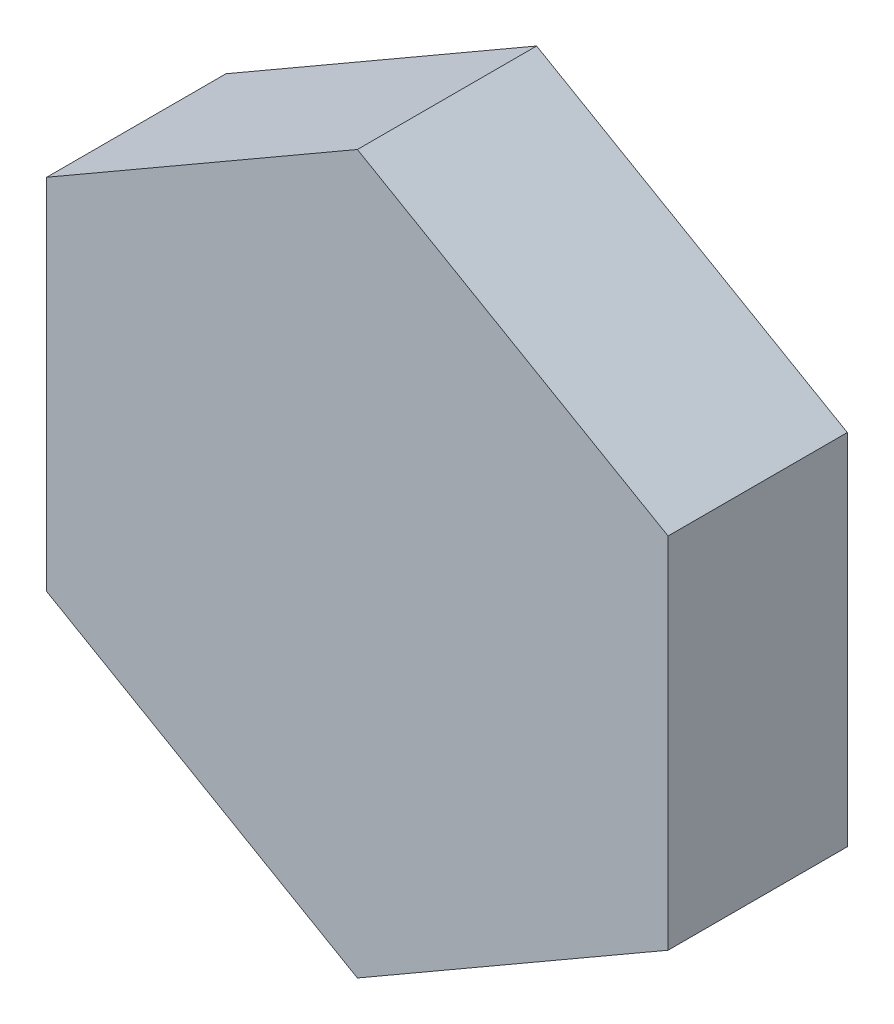
from build123d import *

# Parameters (mm, degrees)
BOSS_EXTRUDE1_DEPTH = 135


with BuildPart() as part:
    # Sketch4 → Boss-Extrude1 (new body)
    with BuildSketch(Plane.XY):
        Polygon((0, -270.199925981), (234, -135.09996299), (234, 135.09996299), (0, 270.199925981), (-234, 135.09996299), (-234, -135.09996299), align=None)
    extrude(amount=BOSS_EXTRUDE1_DEPTH)


solid = part.part
